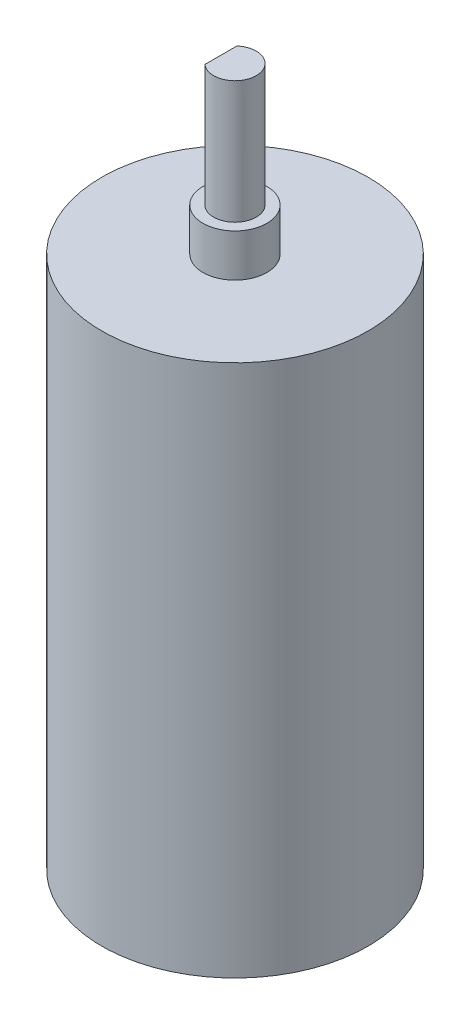
from build123d import *

# Parameters (mm, degrees)
CUT_EXTRUDE1_START = -10
CUT_EXTRUDE1_DEPTH = 10


with BuildPart() as part:
    # Sketch1 → Revolve1 (revolve)
    with BuildSketch(Plane.XY, mode=Mode.PRIVATE) as revolve1_sk:
        Polygon((0, 65.5), (-2, 65.5), (-2, 54), (-3, 54), (-3, 50), (-12.5, 50), (-12.5, 0), (0, 0), align=None)
    revolve(revolve1_sk.sketch.rotate(Axis((0, 0, 0), (0, 1, 0)), 270), axis=Axis((0, 0, 0), (0, 1, 0)))

    # Sketch2 → Cut-Extrude1 (cut)
    with BuildSketch(Plane(origin=(0, 65.5, 0), x_dir=(1, 0, 0), z_dir=(0, 1, 0)).offset(CUT_EXTRUDE1_START)):
        with BuildLine():
            Line((-1.322875656, 1.5), (-1.322875656, -1.5))
            ThreePointArc((-1.322875656, -1.5), (-2, 0), (-1.322875656, 1.5))
        make_face()
    extrude(amount=CUT_EXTRUDE1_DEPTH, mode=Mode.SUBTRACT)


solid = part.part
